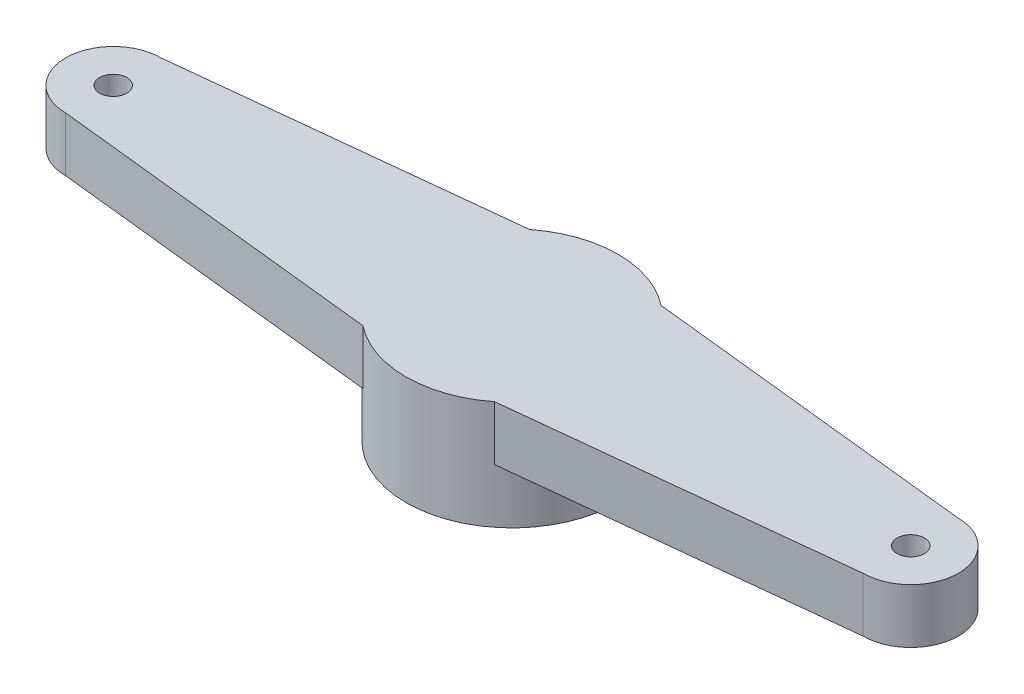
from build123d import *

# Parameters (mm, degrees)
BOSS_EXTRUDE1_DEPTH      = 2
BOSS_EXTRUDE1_DEPTH_BACK = 2
SKETCH3_R                = 3.9
SKETCH5_R                = 0.5
BOSS_EXTRUDE4_DEPTH      = 2
SKETCH4_R                = 2.25
CUT_EXTRUDE1_DEPTH       = 47.91271215


with BuildPart() as part:
    # Sketch3 → Boss-Extrude1 (new, two sides: drawn at the far end of the back side and taken through both)
    with BuildSketch(Plane(origin=(0, 0, 0), x_dir=(1, 0, 0), z_dir=(0, 1, 0)).offset(-BOSS_EXTRUDE1_DEPTH_BACK)):
        with Locations((-5.706641347, -37.429153992)):
            Circle(SKETCH3_R)
    extrude(amount=BOSS_EXTRUDE1_DEPTH + BOSS_EXTRUDE1_DEPTH_BACK)

    # Sketch5 → Boss-Extrude4 (add)
    with BuildSketch(Plane(origin=(0, 0, 0), x_dir=(1, 0, 0), z_dir=(0, 1, 0))):
        with BuildLine():
            Line((8.943358653, -35.679153992), (-5.706641347, -34.108983126))
            Line((-5.706641347, -34.108983126), (-20.356641347, -35.679153992))
            ThreePointArc((-20.356641347, -35.679153992), (-22.106641347, -37.429153992), (-20.356641347, -39.179153992))
            Line((-20.356641347, -39.179153992), (-5.706641347, -40.749324858))
            Line((-5.706641347, -40.749324858), (8.943358653, -39.179153992))
            ThreePointArc((8.943358653, -39.179153992), (10.693358653, -37.429153992), (8.943358653, -35.679153992))
        make_face()
        with Locations((8.943358653, -37.429153992)):
            Circle(SKETCH5_R, mode=Mode.SUBTRACT)
        with Locations((-20.356641347, -37.429153992)):
            Circle(SKETCH5_R, mode=Mode.SUBTRACT)
    extrude(amount=BOSS_EXTRUDE4_DEPTH)

    # Sketch4 → Cut-Extrude1 (cut, through all)
    with BuildSketch(Plane(origin=(0, 0, 0), x_dir=(1, 0, 0), z_dir=(0, 1, 0))):
        with Locations((-5.706641347, -37.429153992)):
            Circle(SKETCH4_R)
    extrude(amount=-CUT_EXTRUDE1_DEPTH, mode=Mode.SUBTRACT)


solid = part.part
